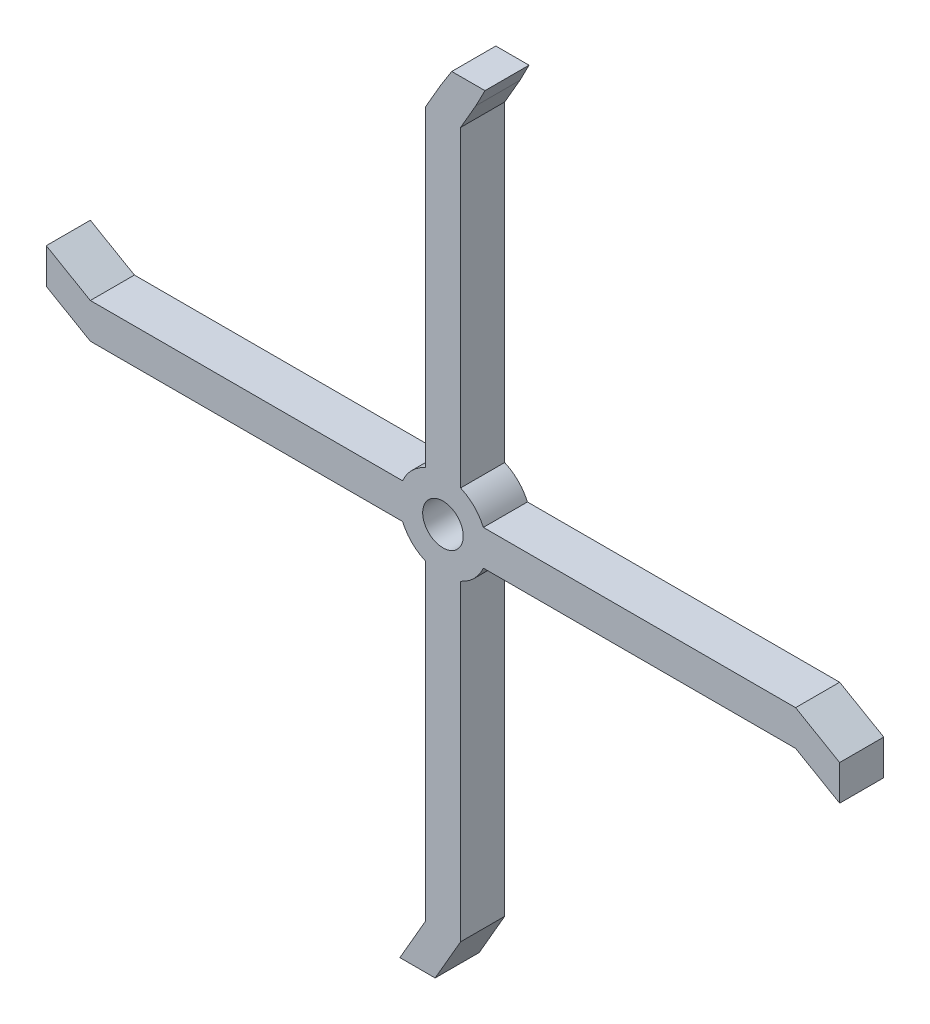
from build123d import *

# Parameters (mm, degrees)
SKETCH_1_R      = 5
SKETCH_1_R_2    = 2.3
EXTRUDE_1_DEPTH = 5
SKETCH_2_W      = 2
SKETCH_2_H      = 35.417424305
SKETCH_2_W_2    = 35.417424305
SKETCH_2_H_2    = 2
EXTRUDE_2_DEPTH = 5


with BuildPart() as part:
    # ｽｹｯﾁ1 → ﾎﾞｽ - 押し出し1 (new body)
    with BuildSketch(Plane.XY):
        Circle(SKETCH_1_R)
        Circle(SKETCH_1_R_2, mode=Mode.SUBTRACT)
    extrude(amount=EXTRUDE_1_DEPTH)

    # ｽｹｯﾁ2 → ﾎﾞｽ - 押し出し2 (add)
    with BuildSketch(Plane.XY):
        with Locations((1, 22.291287848)):
            Rectangle(SKETCH_2_W, SKETCH_2_H)
        with Locations((-1, 22.291287848)):
            Rectangle(SKETCH_2_W, SKETCH_2_H)
        Polygon((-2, 40), (0, 40), (2, 40), (3.728267906, 42.993447822), (-0.271732094, 42.993447822), align=None)
        Polygon((4.765204655, 45), (3.728267906, 42.993447822), (-0.271732094, 42.993447822), (0.996826512, 45), align=None)
        with Locations((-22.291287848, 1)):
            Rectangle(SKETCH_2_W_2, SKETCH_2_H_2)
        with Locations((-22.291287848, -1)):
            Rectangle(SKETCH_2_W_2, SKETCH_2_H_2)
        Polygon((-40, -2), (-40, 0), (-40, 2), (-45, 4.886751346), (-45, 0.886751346), align=None)
        with Locations((22.291287848, -1)):
            Rectangle(SKETCH_2_W_2, SKETCH_2_H_2)
        with Locations((22.291287848, 1)):
            Rectangle(SKETCH_2_W_2, SKETCH_2_H_2)
        Polygon((45, -4.886751346), (40, -2), (40, 2), (45, -0.886751346), align=None)
        with Locations((1, -22.291287848)):
            Rectangle(SKETCH_2_W, SKETCH_2_H)
        with Locations((-1, -22.291287848)):
            Rectangle(SKETCH_2_W, SKETCH_2_H)
        Polygon((-4.886751346, -45), (-0.886751346, -45), (2, -40), (0, -40), (-2, -40), align=None)
    extrude(amount=EXTRUDE_2_DEPTH)


solid = part.part
